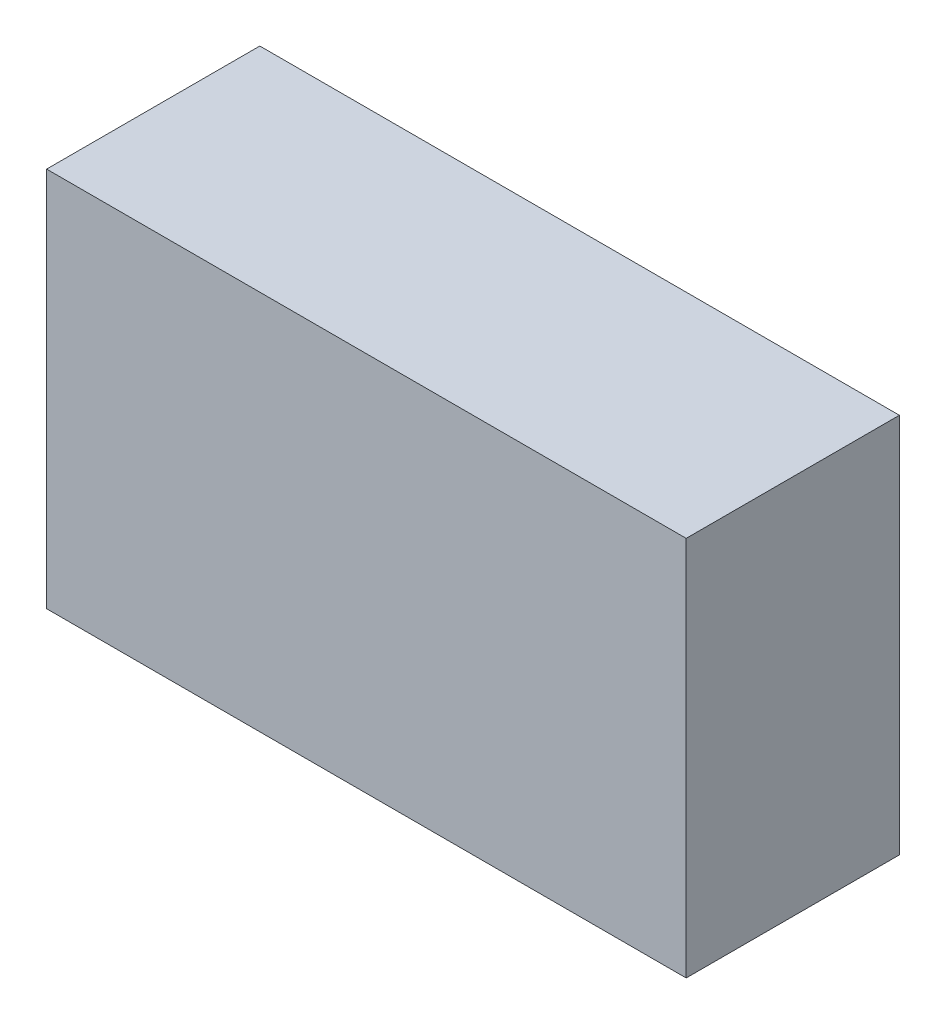
from build123d import *

# Parameters (mm, degrees)
SKETCH1_W           = 50
SKETCH1_H           = 89.3
BOSS_EXTRUDE1_DEPTH = 75


with BuildPart() as part:
    # Sketch1 → Boss-Extrude1 (new, symmetric)
    with BuildSketch(Plane(origin=(0, 0, 0), x_dir=(0, 0, -1), z_dir=(1, 0, 0))):
        with Locations((-25, -44.65)):
            Rectangle(SKETCH1_W, SKETCH1_H)
    extrude(amount=BOSS_EXTRUDE1_DEPTH, both=True)


solid = part.part
